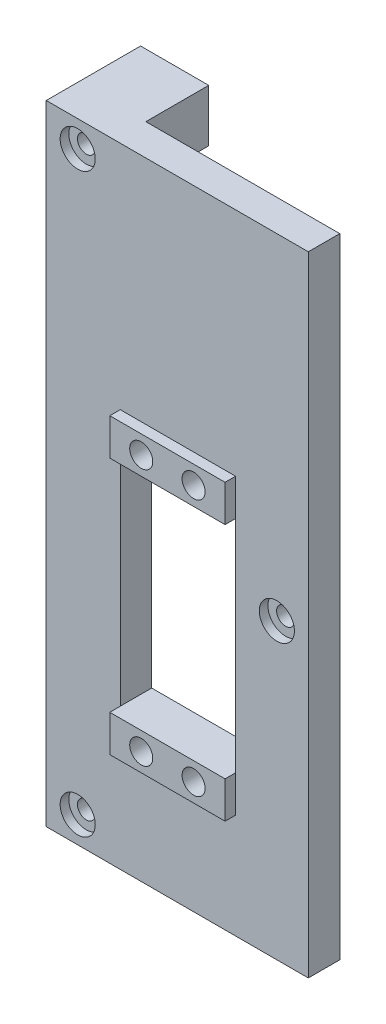
from build123d import *

# Parameters (mm, degrees)
SKETCH1_W                       = 120
SKETCH1_H                       = 50
BOSS_EXTRUDE1_DEPTH             = 6
SKETCH2_W                       = 50
SKETCH2_H                       = 10
BOSS_EXTRUDE2_DEPTH             = 12
SKETCH3_R                       = 1.7
CUT_EXTRUDE1_DEPTH              = 19
SKETCH5_W                       = 10
SKETCH5_H                       = 12
CUT_EXTRUDE2_DEPTH              = 37
CBORE_FOR_M3_SBHCS2_D           = 3.4
CBORE_FOR_M3_SBHCS2_DEPTH       = 3.15
CBORE_FOR_M3_SBHCS2_CBORE_D     = 6.7
CBORE_FOR_M3_SBHCS2_CBORE_DEPTH = 1.65
CBORE_FOR_M3_SBHCS2_TIP         = 1.021463052
SKETCH6_R                       = 1.7
CUT_EXTRUDE3_DEPTH              = 6
CBORE_FOR_M3_SBHCS3_D           = 3.4
CBORE_FOR_M3_SBHCS3_DEPTH       = 3.15
CBORE_FOR_M3_SBHCS3_CBORE_D     = 6.7
CBORE_FOR_M3_SBHCS3_CBORE_DEPTH = 1.65
CBORE_FOR_M3_SBHCS3_TIP         = 1.021463052
SKETCH9_R                       = 3.2
CUT_EXTRUDE4_DEPTH              = 7
SKETCH10_W                      = 22
SKETCH10_H                      = 42
CUT_EXTRUDE5_DEPTH              = 6.5
SKETCH11_W                      = 22
SKETCH11_H                      = 7
SKETCH11_R                      = 2.2
BOSS_EXTRUDE4_DEPTH             = 2
CUT_EXTRUDE6_START              = -6
SKETCH12_R                      = 2.2
CUT_EXTRUDE6_DEPTH              = 6


with BuildPart() as part:
    # Sketch1 → Boss-Extrude1 (new body)
    with BuildSketch(Plane(origin=(0, 0, 0), x_dir=(0, 1, 0), z_dir=(0, 0, 1))):
        Rectangle(SKETCH1_W, SKETCH1_H)
    extrude(amount=BOSS_EXTRUDE1_DEPTH)

    # Sketch2 → Boss-Extrude2 (add)
    with BuildSketch(Plane(origin=(0, 0, 0), x_dir=(1, 0, 0), z_dir=(0, 0, -1))):
        with Locations((0, 55)):
            Rectangle(SKETCH2_W, SKETCH2_H)
        with Locations((0, -55)):
            Rectangle(SKETCH2_W, SKETCH2_H)
    extrude(amount=BOSS_EXTRUDE2_DEPTH)

    # Sketch3 → Cut-Extrude1 (cut)
    with BuildSketch(Plane.XY.offset(6)):
        with Locations((-19, -55)):
            Circle(SKETCH3_R)
        with Locations(Location((-19, 55, 0), (0, 0, 180))):
            Circle(SKETCH3_R)
    extrude(amount=-CUT_EXTRUDE1_DEPTH, mode=Mode.SUBTRACT)

    # Sketch5 → Cut-Extrude2 (cut)
    with BuildSketch(Plane.YZ.offset(25)):
        with Locations((-55, -6)):
            Rectangle(SKETCH5_W, SKETCH5_H)
        with Locations((55, -6)):
            Rectangle(SKETCH5_W, SKETCH5_H)
    extrude(amount=-CUT_EXTRUDE2_DEPTH, mode=Mode.SUBTRACT)

    # CBORE for M3 SBHCS2
    with Locations(Plane(origin=(-19, 55, 6), x_dir=(1, 0, 0), z_dir=(0, 0, 1))):
        with Locations((0, 0), (0, -110)):
            CounterBoreHole(CBORE_FOR_M3_SBHCS2_D / 2, CBORE_FOR_M3_SBHCS2_CBORE_D / 2, CBORE_FOR_M3_SBHCS2_CBORE_DEPTH, depth=CBORE_FOR_M3_SBHCS2_DEPTH)
            with Locations((0, 0, -(CBORE_FOR_M3_SBHCS2_DEPTH + CBORE_FOR_M3_SBHCS2_TIP / 2))):  # 118° drill point
                Cone(0, CBORE_FOR_M3_SBHCS2_D / 2, CBORE_FOR_M3_SBHCS2_TIP, mode=Mode.SUBTRACT)

    # Sketch6 → Cut-Extrude3 (cut)
    with BuildSketch(Plane(origin=(0, 0, 0), x_dir=(1, 0, 0), z_dir=(0, 0, -1))):
        with Locations(Location((19, 4, 0), (0, 0, 180))):
            Circle(SKETCH6_R)
    extrude(amount=-CUT_EXTRUDE3_DEPTH, mode=Mode.SUBTRACT)

    # CBORE for M3 SBHCS3
    with Locations(Plane(origin=(19, -4, 6), x_dir=(1, 0, 0), z_dir=(0, 0, 1))):
        with Locations((0, 0)):
            CounterBoreHole(CBORE_FOR_M3_SBHCS3_D / 2, CBORE_FOR_M3_SBHCS3_CBORE_D / 2, CBORE_FOR_M3_SBHCS3_CBORE_DEPTH, depth=CBORE_FOR_M3_SBHCS3_DEPTH)
            with Locations((0, 0, -(CBORE_FOR_M3_SBHCS3_DEPTH + CBORE_FOR_M3_SBHCS3_TIP / 2))):  # 118° drill point
                Cone(0, CBORE_FOR_M3_SBHCS3_D / 2, CBORE_FOR_M3_SBHCS3_TIP, mode=Mode.SUBTRACT)

    # Sketch9 → Cut-Extrude4 (cut)
    with BuildSketch(Plane.XY.offset(6)):
        with Locations((0.12, -22.03)):
            Circle(SKETCH9_R)
    extrude(amount=-CUT_EXTRUDE4_DEPTH, mode=Mode.SUBTRACT)

    # Sketch10 → Cut-Extrude5 (cut)
    with BuildSketch(Plane.XY.offset(6)):
        with Locations((0.12, -12.03)):
            Rectangle(SKETCH10_W, SKETCH10_H)
    extrude(amount=-CUT_EXTRUDE5_DEPTH, mode=Mode.SUBTRACT)

    # Sketch11 → Boss-Extrude4 (add)
    # profile 1 of 2: a face of its own
    with BuildSketch(Plane.XY.offset(6)):
        with Locations((0.12, -36.53)):
            Rectangle(SKETCH11_W, SKETCH11_H)
        with Locations((-4.88, -36.53)):
            Circle(SKETCH11_R, mode=Mode.SUBTRACT)
        with Locations((5.12, -36.53)):
            Circle(SKETCH11_R, mode=Mode.SUBTRACT)
    # profile 2 of 2: a face of its own
    with BuildSketch(Plane.XY.offset(6)):
        with Locations((0.12, 12.47)):
            Rectangle(SKETCH11_W, SKETCH11_H)
        with Locations(Location((5.12, 12.47, 0), (0, 0, 180))):
            Circle(SKETCH11_R, mode=Mode.SUBTRACT)
        with Locations(Location((-4.88, 12.47, 0), (0, 0, 180))):
            Circle(SKETCH11_R, mode=Mode.SUBTRACT)
    extrude(amount=BOSS_EXTRUDE4_DEPTH)

    # Sketch12 → Cut-Extrude6 (cut)
    with BuildSketch(Plane.XY.offset(6).offset(CUT_EXTRUDE6_START)):
        with Locations((-4.88, -36.53)):
            Circle(SKETCH12_R)
        with Locations((5.12, -36.53)):
            Circle(SKETCH12_R)
        with Locations(Location((-4.88, 12.47, 0), (0, 0, 180))):
            Circle(SKETCH12_R)
        with Locations(Location((5.12, 12.47, 0), (0, 0, 180))):
            Circle(SKETCH12_R)
    extrude(amount=CUT_EXTRUDE6_DEPTH, mode=Mode.SUBTRACT)


solid = part.part
